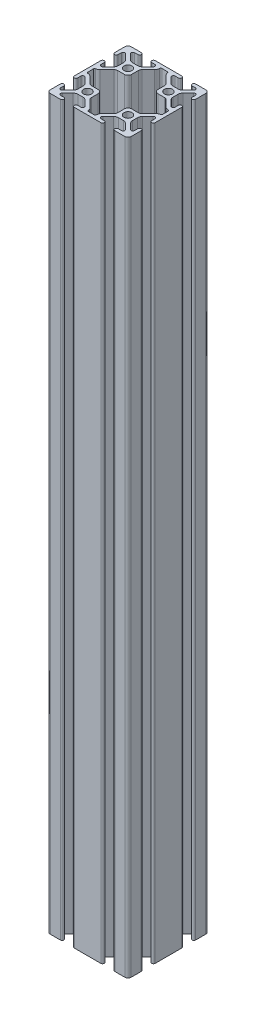
from build123d import *

# Parameters (mm, degrees)
SKETCH13_R                             = 2.5
F_25_SERIES_EXTRUSIONS_25_5050_1_DEPTH = 450


with BuildPart() as part:
    # Sketch13 → 25 series extrusions 25-5050(1) (new body)
    with BuildSketch(Plane(origin=(0, 0, 0), x_dir=(-1, 0, 0), z_dir=(0, 1, 0))):
        with BuildLine():
            Line((16.815, -25), (23, -25))
            ThreePointArc((23, -25), (24.414213562, -24.414213562), (25, -23))
            Line((25, -23), (25, -16.815))
            ThreePointArc((25, -16.815), (23.935, -15.75), (22.87, -16.815))
            Line((22.87, -16.815), (22.87, -18.772801987))
            ThreePointArc((22.87, -18.772801987), (22.208114403, -19.763383786), (21.039643501, -19.530960473))
            Line((21.039643501, -19.530960473), (17.811043881, -16.302360852))
            ThreePointArc((17.811043881, -16.302360852), (17.122790395, -15.27231672), (16.881107911, -14.057296822))
            Line((16.881107911, -14.057296822), (16.881107911, -10.942703178))
            ThreePointArc((16.881107911, -10.942703178), (17.122790395, -9.72768328), (17.811043881, -8.697639148))
            Line((17.811043881, -8.697639148), (21.039643501, -5.469039527))
            ThreePointArc((21.039643501, -5.469039527), (22.208114403, -5.236616214), (22.87, -6.227198013))
            Line((22.87, -6.227198013), (22.87, -8.185))
            ThreePointArc((22.87, -8.185), (23.935, -9.25), (25, -8.185))
            Line((25, -8.185), (25, 8.185))
            ThreePointArc((25, 8.185), (23.935, 9.25), (22.87, 8.185))
            Line((22.87, 8.185), (22.87, 6.227198013))
            ThreePointArc((22.87, 6.227198013), (22.208114403, 5.236616214), (21.039643501, 5.469039527))
            Line((21.039643501, 5.469039527), (17.811043881, 8.697639148))
            ThreePointArc((17.811043881, 8.697639148), (17.122790395, 9.72768328), (16.881107911, 10.942703178))
            Line((16.881107911, 10.942703178), (16.881107911, 14.057296822))
            ThreePointArc((16.881107911, 14.057296822), (17.122790395, 15.27231672), (17.811043881, 16.302360852))
            Line((17.811043881, 16.302360852), (21.039643501, 19.530960473))
            ThreePointArc((21.039643501, 19.530960473), (22.208114403, 19.763383786), (22.87, 18.772801987))
            Line((22.87, 18.772801987), (22.87, 16.815))
            ThreePointArc((22.87, 16.815), (23.935, 15.75), (25, 16.815))
            Line((25, 16.815), (25, 23))
            ThreePointArc((25, 23), (24.414213562, 24.414213562), (23, 25))
            Line((23, 25), (16.815, 25))
            ThreePointArc((16.815, 25), (15.75, 23.935), (16.815, 22.87))
            Line((16.815, 22.87), (18.772801987, 22.87))
            ThreePointArc((18.772801987, 22.87), (19.763383786, 22.208114403), (19.530960473, 21.039643501))
            Line((19.530960473, 21.039643501), (16.302360852, 17.811043881))
            ThreePointArc((16.302360852, 17.811043881), (15.27231672, 17.122790395), (14.057296822, 16.881107911))
            Line((14.057296822, 16.881107911), (10.942703178, 16.881107911))
            ThreePointArc((10.942703178, 16.881107911), (9.72768328, 17.122790395), (8.697639148, 17.811043881))
            Line((8.697639148, 17.811043881), (5.469039527, 21.039643501))
            ThreePointArc((5.469039527, 21.039643501), (5.236616214, 22.208114403), (6.227198013, 22.87))
            Line((6.227198013, 22.87), (8.185, 22.87))
            ThreePointArc((8.185, 22.87), (9.25, 23.935), (8.185, 25))
            Line((8.185, 25), (-8.185, 25))
            ThreePointArc((-8.185, 25), (-9.25, 23.935), (-8.185, 22.87))
            Line((-8.185, 22.87), (-6.227198013, 22.87))
            ThreePointArc((-6.227198013, 22.87), (-5.236616214, 22.208114403), (-5.469039527, 21.039643501))
            Line((-5.469039527, 21.039643501), (-8.697639148, 17.811043881))
            ThreePointArc((-8.697639148, 17.811043881), (-9.72768328, 17.122790395), (-10.942703178, 16.881107911))
            Line((-10.942703178, 16.881107911), (-14.057296822, 16.881107911))
            ThreePointArc((-14.057296822, 16.881107911), (-15.27231672, 17.122790395), (-16.302360852, 17.811043881))
            Line((-16.302360852, 17.811043881), (-19.530960473, 21.039643501))
            ThreePointArc((-19.530960473, 21.039643501), (-19.763383786, 22.208114403), (-18.772801987, 22.87))
            Line((-18.772801987, 22.87), (-16.815, 22.87))
            ThreePointArc((-16.815, 22.87), (-15.75, 23.935), (-16.815, 25))
            Line((-16.815, 25), (-23, 25))
            ThreePointArc((-23, 25), (-24.414213562, 24.414213562), (-25, 23))
            Line((-25, 23), (-25, 16.815))
            ThreePointArc((-25, 16.815), (-23.935, 15.75), (-22.87, 16.815))
            Line((-22.87, 16.815), (-22.87, 18.772801987))
            ThreePointArc((-22.87, 18.772801987), (-22.208114403, 19.763383786), (-21.039643501, 19.530960473))
            Line((-21.039643501, 19.530960473), (-17.811043881, 16.302360852))
            ThreePointArc((-17.811043881, 16.302360852), (-17.122790395, 15.27231672), (-16.881107911, 14.057296822))
            Line((-16.881107911, 14.057296822), (-16.881107911, 10.942703178))
            ThreePointArc((-16.881107911, 10.942703178), (-17.122790395, 9.72768328), (-17.811043881, 8.697639148))
            Line((-17.811043881, 8.697639148), (-21.039643501, 5.469039527))
            ThreePointArc((-21.039643501, 5.469039527), (-22.208114403, 5.236616214), (-22.87, 6.227198013))
            Line((-22.87, 6.227198013), (-22.87, 8.185))
            ThreePointArc((-22.87, 8.185), (-23.935, 9.25), (-25, 8.185))
            Line((-25, 8.185), (-25, -8.185))
            ThreePointArc((-25, -8.185), (-23.935, -9.25), (-22.87, -8.185))
            Line((-22.87, -8.185), (-22.87, -6.227198013))
            ThreePointArc((-22.87, -6.227198013), (-22.208114403, -5.236616214), (-21.039643501, -5.469039527))
            Line((-21.039643501, -5.469039527), (-17.811043881, -8.697639148))
            ThreePointArc((-17.811043881, -8.697639148), (-17.122790395, -9.72768328), (-16.881107911, -10.942703178))
            Line((-16.881107911, -10.942703178), (-16.881107911, -14.057296822))
            ThreePointArc((-16.881107911, -14.057296822), (-17.122790395, -15.27231672), (-17.811043881, -16.302360852))
            Line((-17.811043881, -16.302360852), (-21.039643501, -19.530960473))
            ThreePointArc((-21.039643501, -19.530960473), (-22.208114403, -19.763383786), (-22.87, -18.772801987))
            Line((-22.87, -18.772801987), (-22.87, -16.815))
            ThreePointArc((-22.87, -16.815), (-23.935, -15.75), (-25, -16.815))
            Line((-25, -16.815), (-25, -23))
            ThreePointArc((-25, -23), (-24.414213562, -24.414213562), (-23, -25))
            Line((-23, -25), (-16.815, -25))
            ThreePointArc((-16.815, -25), (-15.75, -23.935), (-16.815, -22.87))
            Line((-16.815, -22.87), (-18.772801987, -22.87))
            ThreePointArc((-18.772801987, -22.87), (-19.763383786, -22.208114403), (-19.530960473, -21.039643501))
            Line((-19.530960473, -21.039643501), (-16.302360852, -17.811043881))
            ThreePointArc((-16.302360852, -17.811043881), (-15.27231672, -17.122790395), (-14.057296822, -16.881107911))
            Line((-14.057296822, -16.881107911), (-10.942703178, -16.881107911))
            ThreePointArc((-10.942703178, -16.881107911), (-9.72768328, -17.122790395), (-8.697639148, -17.811043881))
            Line((-8.697639148, -17.811043881), (-5.469039527, -21.039643501))
            ThreePointArc((-5.469039527, -21.039643501), (-5.236616214, -22.208114403), (-6.227198013, -22.87))
            Line((-6.227198013, -22.87), (-8.185, -22.87))
            ThreePointArc((-8.185, -22.87), (-9.25, -23.935), (-8.185, -25))
            Line((-8.185, -25), (8.185, -25))
            ThreePointArc((8.185, -25), (9.25, -23.935), (8.185, -22.87))
            Line((8.185, -22.87), (6.227198013, -22.87))
            ThreePointArc((6.227198013, -22.87), (5.236616214, -22.208114403), (5.469039527, -21.039643501))
            Line((5.469039527, -21.039643501), (8.697639148, -17.811043881))
            ThreePointArc((8.697639148, -17.811043881), (9.72768328, -17.122790395), (10.942703178, -16.881107911))
            Line((10.942703178, -16.881107911), (14.057296822, -16.881107911))
            ThreePointArc((14.057296822, -16.881107911), (15.27231672, -17.122790395), (16.302360852, -17.811043881))
            Line((16.302360852, -17.811043881), (19.530960473, -21.039643501))
            ThreePointArc((19.530960473, -21.039643501), (19.763383786, -22.208114403), (18.772801987, -22.87))
            Line((18.772801987, -22.87), (16.815, -22.87))
            ThreePointArc((16.815, -22.87), (15.75, -23.935), (16.815, -25))
        make_face()
        with Locations((12.5, 12.5)):
            Circle(SKETCH13_R, mode=Mode.SUBTRACT)
        with Locations((-12.5, -12.5)):
            Circle(SKETCH13_R, mode=Mode.SUBTRACT)
        with Locations((12.5, -12.5)):
            Circle(SKETCH13_R, mode=Mode.SUBTRACT)
        with Locations((-12.5, 12.5)):
            Circle(SKETCH13_R, mode=Mode.SUBTRACT)
        with BuildLine():
            Line((1.940045032, -22.8664), (-1.460974251, -22.8664))
            ThreePointArc((-1.460974251, -22.8664), (-1.963491172, -22.677218248), (-2.216488324, -22.203609304))
            ThreePointArc((-2.216488324, -22.203609304), (-2.516658833, -21.213189093), (-3.119399596, -20.371917375))
            Line((-3.119399596, -20.371917375), (-7.471656654, -16.019660318))
            ThreePointArc((-7.471656654, -16.019660318), (-7.95068108, -15.302749601), (-8.118892089, -14.457095752))
            Line((-8.118892089, -14.457095752), (-8.118892089, -10.328692089))
            ThreePointArc((-8.118892089, -10.328692089), (-8.766127524, -8.766127524), (-10.328692089, -8.118892089))
            Line((-10.328692089, -8.118892089), (-14.457095752, -8.118892089))
            ThreePointArc((-14.457095752, -8.118892089), (-15.302749601, -7.95068108), (-16.019660318, -7.471656654))
            Line((-16.019660318, -7.471656654), (-19.85933597, -3.631981002))
            ThreePointArc((-19.85933597, -3.631981002), (-20.889380102, -2.943727516), (-22.1044, -2.702045032))
            ThreePointArc((-22.1044, -2.702045032), (-22.643215367, -2.478860399), (-22.8664, -1.940045032))
            Line((-22.8664, -1.940045032), (-22.8664, 1.460974251))
            ThreePointArc((-22.8664, 1.460974251), (-22.677218248, 1.963491172), (-22.203609304, 2.216488324))
            ThreePointArc((-22.203609304, 2.216488324), (-21.213189093, 2.516658833), (-20.371917375, 3.119399596))
            Line((-20.371917375, 3.119399596), (-16.019660318, 7.471656654))
            ThreePointArc((-16.019660318, 7.471656654), (-15.302749601, 7.95068108), (-14.457095752, 8.118892089))
            Line((-14.457095752, 8.118892089), (-10.328692089, 8.118892089))
            ThreePointArc((-10.328692089, 8.118892089), (-8.766127524, 8.766127524), (-8.118892089, 10.328692089))
            Line((-8.118892089, 10.328692089), (-8.118892089, 14.457095752))
            ThreePointArc((-8.118892089, 14.457095752), (-7.95068108, 15.302749601), (-7.471656654, 16.019660318))
            Line((-7.471656654, 16.019660318), (-3.631981002, 19.85933597))
            ThreePointArc((-3.631981002, 19.85933597), (-2.943727516, 20.889380102), (-2.702045032, 22.1044))
            ThreePointArc((-2.702045032, 22.1044), (-2.478860399, 22.643215367), (-1.940045032, 22.8664))
            Line((-1.940045032, 22.8664), (1.460974251, 22.8664))
            ThreePointArc((1.460974251, 22.8664), (1.963491172, 22.677218248), (2.216488324, 22.203609304))
            ThreePointArc((2.216488324, 22.203609304), (2.516658833, 21.213189093), (3.119399596, 20.371917375))
            Line((3.119399596, 20.371917375), (7.471656654, 16.019660318))
            ThreePointArc((7.471656654, 16.019660318), (7.95068108, 15.302749601), (8.118892089, 14.457095752))
            Line((8.118892089, 14.457095752), (8.118892089, 10.328692089))
            ThreePointArc((8.118892089, 10.328692089), (8.766127524, 8.766127524), (10.328692089, 8.118892089))
            Line((10.328692089, 8.118892089), (14.457095752, 8.118892089))
            ThreePointArc((14.457095752, 8.118892089), (15.302749601, 7.95068108), (16.019660318, 7.471656654))
            Line((16.019660318, 7.471656654), (19.85933597, 3.631981002))
            ThreePointArc((19.85933597, 3.631981002), (20.889380102, 2.943727516), (22.1044, 2.702045032))
            ThreePointArc((22.1044, 2.702045032), (22.643215367, 2.478860399), (22.8664, 1.940045032))
            Line((22.8664, 1.940045032), (22.8664, -1.460974251))
            ThreePointArc((22.8664, -1.460974251), (22.677218248, -1.963491172), (22.203609304, -2.216488324))
            ThreePointArc((22.203609304, -2.216488324), (21.213189093, -2.516658833), (20.371917375, -3.119399596))
            Line((20.371917375, -3.119399596), (16.019660318, -7.471656654))
            ThreePointArc((16.019660318, -7.471656654), (15.302749601, -7.95068108), (14.457095752, -8.118892089))
            Line((14.457095752, -8.118892089), (10.328692089, -8.118892089))
            ThreePointArc((10.328692089, -8.118892089), (8.766127524, -8.766127524), (8.118892089, -10.328692089))
            Line((8.118892089, -10.328692089), (8.118892089, -14.457095752))
            ThreePointArc((8.118892089, -14.457095752), (7.95068108, -15.302749601), (7.471656654, -16.019660318))
            Line((7.471656654, -16.019660318), (3.631981002, -19.85933597))
            ThreePointArc((3.631981002, -19.85933597), (2.943727516, -20.889380102), (2.702045032, -22.1044))
            ThreePointArc((2.702045032, -22.1044), (2.478860399, -22.643215367), (1.940045032, -22.8664))
        make_face(mode=Mode.SUBTRACT)
    extrude(amount=F_25_SERIES_EXTRUSIONS_25_5050_1_DEPTH)


solid = part.part
